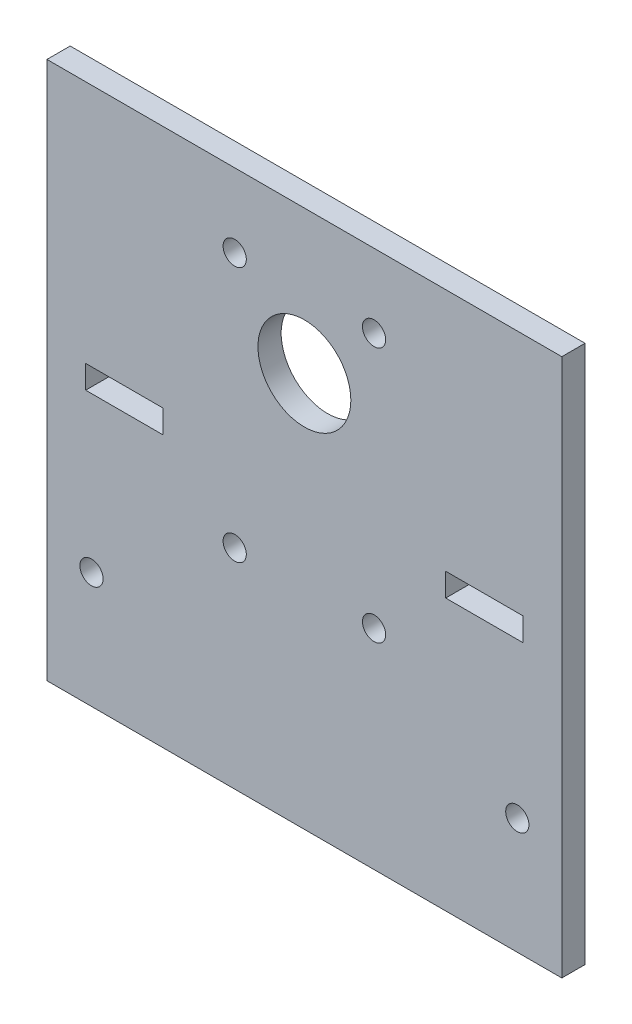
from build123d import *

# Parameters (mm, degrees)
SKETCH1_W           = 66.5
SKETCH1_H           = 69.5
BOSS_EXTRUDE1_DEPTH = 3
CUT_EXTRUDE1_REACH  = 50.188
SKETCH3_R           = 6
SKETCH3_R_2         = 1.5
CUT_EXTRUDE2_REACH  = 50.188
SKETCH4_R           = 1.5
CUT_EXTRUDE3_REACH  = 50.188
SKETCH5_W           = 10
SKETCH5_H           = 3


with BuildPart() as part:
    # Sketch1 → Boss-Extrude1 (new body)
    with BuildSketch(Plane.XY):
        Rectangle(SKETCH1_W, SKETCH1_H)
    extrude(amount=BOSS_EXTRUDE1_DEPTH)

    # Sketch3 → Cut-Extrude1 (cut, up to next)
    with BuildSketch(Plane.XY.offset(3), mode=Mode.PRIVATE) as cut_extrude1_sk1:
        with Locations((0, 16.25)):
            Circle(SKETCH3_R)
    cut_extrude1_tool1 = extrude(cut_extrude1_sk1.sketch, amount=-CUT_EXTRUDE1_REACH, mode=Mode.PRIVATE) & part.part
    # Sketch3 → Cut-Extrude1 (cut, up to next)
    with BuildSketch(Plane.XY.offset(3), mode=Mode.PRIVATE) as cut_extrude1_sk2:
        with Locations((9, 25.25)):
            Circle(SKETCH3_R_2)
    cut_extrude1_tool2 = extrude(cut_extrude1_sk2.sketch, amount=-CUT_EXTRUDE1_REACH, mode=Mode.PRIVATE) & part.part
    # Sketch3 → Cut-Extrude1 (cut, up to next)
    with BuildSketch(Plane.XY.offset(3), mode=Mode.PRIVATE) as cut_extrude1_sk3:
        with Locations((-9, 25.25)):
            Circle(SKETCH3_R_2)
    cut_extrude1_tool3 = extrude(cut_extrude1_sk3.sketch, amount=-CUT_EXTRUDE1_REACH, mode=Mode.PRIVATE) & part.part
    # Sketch3 → Cut-Extrude1 (cut, up to next)
    with BuildSketch(Plane.XY.offset(3), mode=Mode.PRIVATE) as cut_extrude1_sk4:
        with Locations((9, -7.75)):
            Circle(SKETCH3_R_2)
    cut_extrude1_tool4 = extrude(cut_extrude1_sk4.sketch, amount=-CUT_EXTRUDE1_REACH, mode=Mode.PRIVATE) & part.part
    # Sketch3 → Cut-Extrude1 (cut, up to next)
    with BuildSketch(Plane.XY.offset(3), mode=Mode.PRIVATE) as cut_extrude1_sk5:
        with Locations((-9, -7.75)):
            Circle(SKETCH3_R_2)
    cut_extrude1_tool5 = extrude(cut_extrude1_sk5.sketch, amount=-CUT_EXTRUDE1_REACH, mode=Mode.PRIVATE) & part.part
    add(cut_extrude1_tool1.solids().sort_by_distance((0, 16.25, 3))[0], mode=Mode.SUBTRACT)
    add(cut_extrude1_tool2.solids().sort_by_distance((9, 25.25, 3))[0], mode=Mode.SUBTRACT)
    add(cut_extrude1_tool3.solids().sort_by_distance((-9, 25.25, 3))[0], mode=Mode.SUBTRACT)
    add(cut_extrude1_tool4.solids().sort_by_distance((9, -7.75, 3))[0], mode=Mode.SUBTRACT)
    add(cut_extrude1_tool5.solids().sort_by_distance((-9, -7.75, 3))[0], mode=Mode.SUBTRACT)

    # Sketch4 → Cut-Extrude2 (cut, up to next)
    with BuildSketch(Plane.XY.offset(3), mode=Mode.PRIVATE) as cut_extrude2_sk1:
        with Locations((27.5, -19.75)):
            Circle(SKETCH4_R)
    cut_extrude2_tool1 = extrude(cut_extrude2_sk1.sketch, amount=-CUT_EXTRUDE2_REACH, mode=Mode.PRIVATE) & part.part
    cut_extrude2 = cut_extrude2_tool1.solids().sort_by_distance((27.5, -19.75, 3))[0]
    add(cut_extrude2, mode=Mode.SUBTRACT)

    # Mirror1: Cut-Extrude2 across plane
    add(cut_extrude2.mirror(Plane(origin=(0, 0, 0), x_dir=(0, 0, 1), z_dir=(1, 0, 0))), mode=Mode.SUBTRACT)

    # Sketch5 → Cut-Extrude3 (cut, up to next)
    with BuildSketch(Plane.XY.offset(3), mode=Mode.PRIVATE) as cut_extrude3_sk1:
        with Locations((23.25, 1.75)):
            Rectangle(SKETCH5_W, SKETCH5_H)
    cut_extrude3_tool1 = extrude(cut_extrude3_sk1.sketch, amount=-CUT_EXTRUDE3_REACH, mode=Mode.PRIVATE) & part.part
    cut_extrude3 = cut_extrude3_tool1.solids().sort_by_distance((23.25, 1.75, 3))[0]
    add(cut_extrude3, mode=Mode.SUBTRACT)

    # Mirror2: Cut-Extrude3 across plane
    add(cut_extrude3.mirror(Plane(origin=(0, 0, 0), x_dir=(0, 0, 1), z_dir=(1, 0, 0))), mode=Mode.SUBTRACT)


solid = part.part
